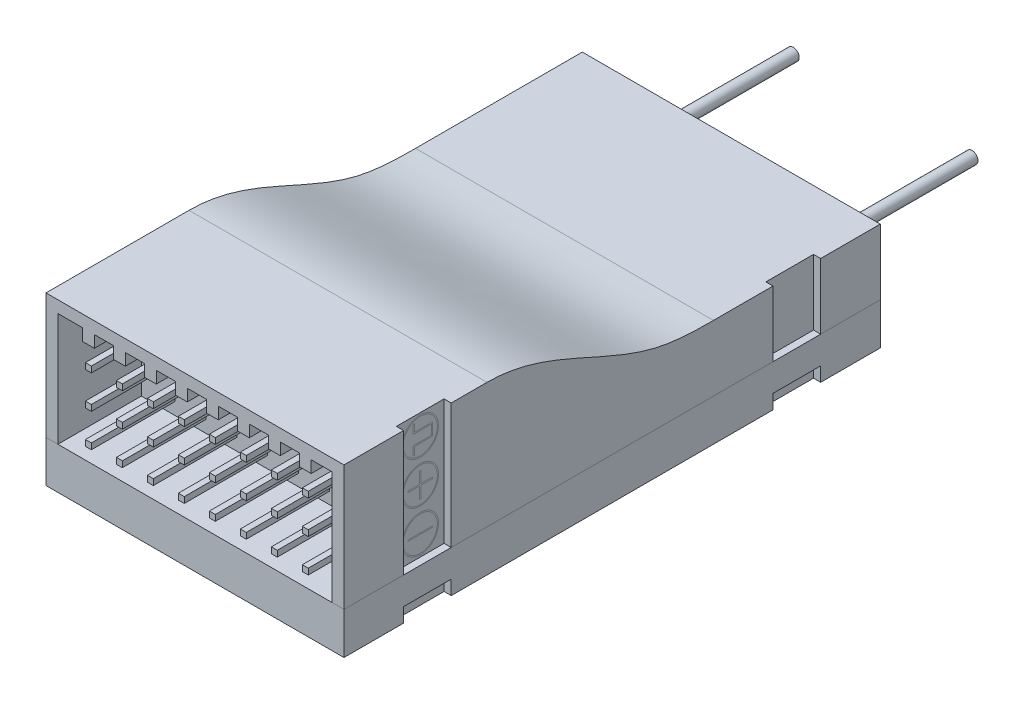
from build123d import *

# Parameters (mm, degrees)
SKETCH1_W               = 25.000000038
SKETCH1_H               = 45
BOSS_EXTRUDE1_DEPTH     = 14
CUT_EXTRUDE1_DEPTH      = 37.43144249
CUT_EXTRUDE1_DEPTH_BACK = 37.43144249
SKETCH3_R               = 0.5
BOSS_EXTRUDE2_DEPTH     = 12.7
SKETCH4_W               = 0.6
SKETCH4_H               = 4
CUT_EXTRUDE2_DEPTH      = 1.2
SKETCH5_W               = 23.000000038
SKETCH5_H               = 9.5
CUT_EXTRUDE3_DEPTH      = 7
CUT_EXTRUDE4_START      = -0.6
SKETCH8_W               = 4
SKETCH8_H               = 10.5
SKETCH8_H_2             = 5.5
CUT_EXTRUDE4_DEPTH      = 0.6
BOSS_EXTRUDE4_REACH     = 62.676
SKETCH6_W               = 1
SKETCH6_H               = 1
SKETCH7_W               = 0.5
SKETCH7_H               = 0.5
BOSS_EXTRUDE5_DEPTH     = 7
L_EK1_SCALE             = 0.5


with BuildPart() as part:
    # Sketch1 → Boss-Extrude1 (new body)
    with BuildSketch(Plane(origin=(0, 0, 0), x_dir=(1, 0, 0), z_dir=(0, 1, 0))):
        Rectangle(SKETCH1_W, SKETCH1_H)
    extrude(amount=BOSS_EXTRUDE1_DEPTH)

    # Sketch2 → Cut-Extrude1 (cut, two sides: drawn at the far end of the back side and taken through both)
    with BuildSketch(Plane(origin=(12.500000019, 0, 0), x_dir=(0, 0, -1), z_dir=(1, 0, 0)).offset(-CUT_EXTRUDE1_DEPTH_BACK)):
        with BuildLine():
            Line((8.5, 9), (22.5, 9))
            Line((22.5, 9), (22.5, 21.156735886))
            Line((22.5, 21.156735886), (-22.5, 21.156735886))
            Line((-22.5, 21.156735886), (-22.5, 14))
            Line((-22.5, 14), (-10.5, 14))
            add(Edge.make_bspline(
                [(-10.5, 14), (-9.181753943, 14), (-4.169696527, 13.06747068), (1.801869655, 9.208989189), (6.832082873, 9), (8.5, 9)],
                knots=[0, 0, 0, 0, 0.196743507, 0.771521248, 1, 1, 1, 1], degree=3))
        make_face()
    extrude(amount=CUT_EXTRUDE1_DEPTH + CUT_EXTRUDE1_DEPTH_BACK, mode=Mode.SUBTRACT)

    # Sketch3 → Boss-Extrude2 (add)
    with BuildSketch(Plane(origin=(0, 0, -22.5), x_dir=(-1, 0, 0), z_dir=(0, 0, -1))):
        with Locations(Location((-7.5, 5, 0), (0, 0, 180))):
            Circle(SKETCH3_R)
        with Locations(Location((7.5, 5, 0), (0, 0, 180))):
            Circle(SKETCH3_R)
    extrude(amount=BOSS_EXTRUDE2_DEPTH)

    # Sketch4 → Cut-Extrude2 (cut)
    with BuildSketch(Plane.XZ):
        with Locations((12.200000019, 15.5)):
            Rectangle(SKETCH4_W, SKETCH4_H)
        with Locations((12.200000019, -15.5)):
            Rectangle(SKETCH4_W, SKETCH4_H)
        with Locations((-12.200000019, -15.5)):
            Rectangle(SKETCH4_W, SKETCH4_H)
        with Locations((-12.200000019, 15.5)):
            Rectangle(SKETCH4_W, SKETCH4_H)
    extrude(amount=-CUT_EXTRUDE2_DEPTH, mode=Mode.SUBTRACT)

    # Sketch5 → Cut-Extrude3 (cut)
    with BuildSketch(Plane.XY.offset(22.5)):
        with Locations((0, 8.25)):
            Rectangle(SKETCH5_W, SKETCH5_H)
    extrude(amount=-CUT_EXTRUDE3_DEPTH, mode=Mode.SUBTRACT)

    # Sketch8 → Cut-Extrude4 (cut)
    with BuildSketch(Plane(origin=(12.500000019, 0, 0), x_dir=(0, 0, -1), z_dir=(1, 0, 0)).offset(CUT_EXTRUDE4_START)):
        with Locations((-15.5, 8.75)):
            Rectangle(SKETCH8_W, SKETCH8_H)
        with Locations((15.5, 6.25)):
            Rectangle(SKETCH8_W, SKETCH8_H_2)
    extrude(amount=CUT_EXTRUDE4_DEPTH, mode=Mode.SUBTRACT)

    # Sketch6 → Boss-Extrude4 (add, up to next)
    with BuildSketch(Plane.XY.offset(22.5), mode=Mode.PRIVATE) as boss_extrude4_sk1:
        with Locations((-6.344444579, 12.5)):
            Rectangle(SKETCH6_W, SKETCH6_H)
    boss_extrude4_tool1 = extrude(boss_extrude4_sk1.sketch, amount=-BOSS_EXTRUDE4_REACH, mode=Mode.PRIVATE) - part.part
    # Sketch6 → Boss-Extrude4 (add, up to next)
    with BuildSketch(Plane.XY.offset(22.5), mode=Mode.PRIVATE) as boss_extrude4_sk2:
        with Locations((-8.944444459, 12.5)):
            Rectangle(SKETCH6_W, SKETCH6_H)
    boss_extrude4_tool2 = extrude(boss_extrude4_sk2.sketch, amount=-BOSS_EXTRUDE4_REACH, mode=Mode.PRIVATE) - part.part
    # Sketch6 → Boss-Extrude4 (add, up to next)
    with BuildSketch(Plane.XY.offset(22.5), mode=Mode.PRIVATE) as boss_extrude4_sk3:
        with Locations((-3.744444699, 12.5)):
            Rectangle(SKETCH6_W, SKETCH6_H)
    boss_extrude4_tool3 = extrude(boss_extrude4_sk3.sketch, amount=-BOSS_EXTRUDE4_REACH, mode=Mode.PRIVATE) - part.part
    # Sketch6 → Boss-Extrude4 (add, up to next)
    with BuildSketch(Plane.XY.offset(22.5), mode=Mode.PRIVATE) as boss_extrude4_sk4:
        with Locations((-1.144444819, 12.5)):
            Rectangle(SKETCH6_W, SKETCH6_H)
    boss_extrude4_tool4 = extrude(boss_extrude4_sk4.sketch, amount=-BOSS_EXTRUDE4_REACH, mode=Mode.PRIVATE) - part.part
    # Sketch6 → Boss-Extrude4 (add, up to next)
    with BuildSketch(Plane.XY.offset(22.5), mode=Mode.PRIVATE) as boss_extrude4_sk5:
        with Locations((1.455555061, 12.5)):
            Rectangle(SKETCH6_W, SKETCH6_H)
    boss_extrude4_tool5 = extrude(boss_extrude4_sk5.sketch, amount=-BOSS_EXTRUDE4_REACH, mode=Mode.PRIVATE) - part.part
    # Sketch6 → Boss-Extrude4 (add, up to next)
    with BuildSketch(Plane.XY.offset(22.5), mode=Mode.PRIVATE) as boss_extrude4_sk6:
        with Locations((4.055554941, 12.5)):
            Rectangle(SKETCH6_W, SKETCH6_H)
    boss_extrude4_tool6 = extrude(boss_extrude4_sk6.sketch, amount=-BOSS_EXTRUDE4_REACH, mode=Mode.PRIVATE) - part.part
    # Sketch6 → Boss-Extrude4 (add, up to next)
    with BuildSketch(Plane.XY.offset(22.5), mode=Mode.PRIVATE) as boss_extrude4_sk7:
        with Locations((6.655554821, 12.5)):
            Rectangle(SKETCH6_W, SKETCH6_H)
    boss_extrude4_tool7 = extrude(boss_extrude4_sk7.sketch, amount=-BOSS_EXTRUDE4_REACH, mode=Mode.PRIVATE) - part.part
    # Sketch6 → Boss-Extrude4 (add, up to next)
    with BuildSketch(Plane.XY.offset(22.5), mode=Mode.PRIVATE) as boss_extrude4_sk8:
        with Locations((9.255554701, 12.5)):
            Rectangle(SKETCH6_W, SKETCH6_H)
    boss_extrude4_tool8 = extrude(boss_extrude4_sk8.sketch, amount=-BOSS_EXTRUDE4_REACH, mode=Mode.PRIVATE) - part.part
    add(boss_extrude4_tool1.solids().sort_by_distance((-6.344445, 12.5, 22.5))[0])
    add(boss_extrude4_tool2.solids().sort_by_distance((-8.944444, 12.5, 22.5))[0])
    add(boss_extrude4_tool3.solids().sort_by_distance((-3.744445, 12.5, 22.5))[0])
    add(boss_extrude4_tool4.solids().sort_by_distance((-1.144445, 12.5, 22.5))[0])
    add(boss_extrude4_tool5.solids().sort_by_distance((1.455555, 12.5, 22.5))[0])
    add(boss_extrude4_tool6.solids().sort_by_distance((4.055555, 12.5, 22.5))[0])
    add(boss_extrude4_tool7.solids().sort_by_distance((6.655555, 12.5, 22.5))[0])
    add(boss_extrude4_tool8.solids().sort_by_distance((9.255555, 12.5, 22.5))[0])

    # Sketch7 → Boss-Extrude5 (add)
    with BuildSketch(Plane.XY.offset(22.5)):
        with Locations((-8.944444459, 4.75)):
            Rectangle(SKETCH7_W, SKETCH7_H)
        with Locations((-6.344444579, 4.75)):
            Rectangle(SKETCH7_W, SKETCH7_H)
        with Locations((-3.744444699, 4.75)):
            Rectangle(SKETCH7_W, SKETCH7_H)
        with Locations((-1.144444819, 4.75)):
            Rectangle(SKETCH7_W, SKETCH7_H)
        with Locations((1.455555061, 4.75)):
            Rectangle(SKETCH7_W, SKETCH7_H)
        with Locations((4.055554941, 4.75)):
            Rectangle(SKETCH7_W, SKETCH7_H)
        with Locations((6.655554821, 4.75)):
            Rectangle(SKETCH7_W, SKETCH7_H)
        with Locations((9.255554701, 4.75)):
            Rectangle(SKETCH7_W, SKETCH7_H)
        with Locations((-8.944444459, 7.544)):
            Rectangle(SKETCH7_W, SKETCH7_H)
        with Locations((-6.344444579, 7.544)):
            Rectangle(SKETCH7_W, SKETCH7_H)
        with Locations((-3.744444699, 7.544)):
            Rectangle(SKETCH7_W, SKETCH7_H)
        with Locations((-1.144444819, 7.544)):
            Rectangle(SKETCH7_W, SKETCH7_H)
        with Locations((1.455555061, 7.544)):
            Rectangle(SKETCH7_W, SKETCH7_H)
        with Locations((4.055554941, 7.544)):
            Rectangle(SKETCH7_W, SKETCH7_H)
        with Locations((6.655554821, 7.544)):
            Rectangle(SKETCH7_W, SKETCH7_H)
        with Locations((9.255554701, 7.544)):
            Rectangle(SKETCH7_W, SKETCH7_H)
        with Locations((-8.944444459, 10.338)):
            Rectangle(SKETCH7_W, SKETCH7_H)
        with Locations((-6.344444579, 10.338)):
            Rectangle(SKETCH7_W, SKETCH7_H)
        with Locations((-3.744444699, 10.338)):
            Rectangle(SKETCH7_W, SKETCH7_H)
        with Locations((-1.144444819, 10.338)):
            Rectangle(SKETCH7_W, SKETCH7_H)
        with Locations((1.455555061, 10.338)):
            Rectangle(SKETCH7_W, SKETCH7_H)
        with Locations((4.055554941, 10.338)):
            Rectangle(SKETCH7_W, SKETCH7_H)
        with Locations((6.655554821, 10.338)):
            Rectangle(SKETCH7_W, SKETCH7_H)
        with Locations((9.255554701, 10.338)):
            Rectangle(SKETCH7_W, SKETCH7_H)
    extrude(amount=-BOSS_EXTRUDE5_DEPTH)


with BuildPart() as part_1:
    # Ölçek1: scaled about (-0.040305617, 5.580646945, 0.225597335)
    add(part.part.scale(L_EK1_SCALE).moved(Location((-0.020152809, 2.790323472, 0.112798668))))


solid = part_1.part
